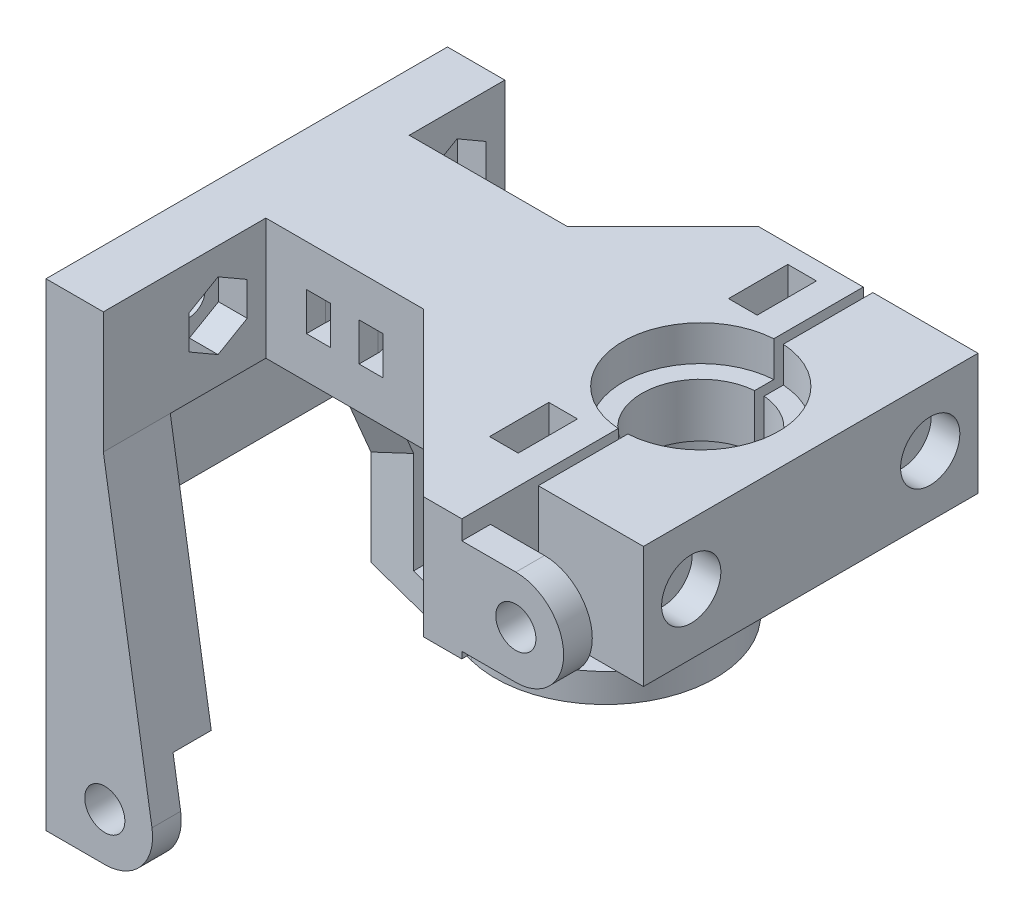
from build123d import *

# Parameters (mm, degrees)
SKETCH_13_R               = 6.15
EXTRUDE_4_DEPTH           = 12.7
CUT_EXTRUDE_11_DEPTH      = 0.5
CUT_EXTRUDE_11_DEPTH_BACK = 0.5
SKETCH_15_W               = 35
SKETCH_15_H               = 12.7
SKETCH_14_R               = 3.1
SKETCH_14_R_2             = 1.65
CUT_EXTRUDE_12_DEPTH      = 3
SKETCH_14_3_R             = 1.65
CUT_EXTRUDE_13_DEPTH      = 25
SKETCH_16_W               = 6.2
SKETCH_16_H               = 12.7
CUT_EXTRUDE_14_DEPTH      = 3
SKETCH_17_R               = 8.15
SKETCH_17_R_2             = 6.15
CUT_EXTRUDE_30_DEPTH      = 3.7
CUT_EXTRUDE_31_DEPTH      = 3.4
SKETCH_19_R               = 1.65
CUT_EXTRUDE_32_DEPTH      = 6
CUT_EXTRUDE_33_DEPTH      = 3
SKETCH_21_W               = 3
SKETCH_21_H               = 35
EXTRUDE_5_DEPTH           = 10
SKETCH_22_R               = 2.1
EXTRUDE_6_DEPTH           = 7
SKETCH_41_W               = 15.059328192
SKETCH_41_H               = 11.44904226
CUT_EXTRUDE_34_DEPTH      = 4
SKETCH_42_W               = 10.65
SKETCH_42_H               = 4
CUT_EXTRUDE_35_DEPTH      = 10
CUT_EXTRUDE_36_DEPTH      = 12.7
EXTRUDE_7_DEPTH           = 12.7
EXTRUDE_8_REACH           = 76.502
SKETCH_44_R               = 6.5
EXTRUDE_9_DEPTH           = 3
EXTRUDE_14_DEPTH          = 3
CUT_EXTRUDE_37_DEPTH      = 2
CUT_EXTRUDE_37_DEPTH_BACK = 2
SKETCH_46_R               = 1.65
EXTRUDE_12_DEPTH          = 0.2
SKETCH_47_R               = 1.65
EXTRUDE_13_DEPTH          = 0.2
EXTRUDE_15_REACH          = 75.95
EXTRUDE_16_REACH          = 75.95


with BuildPart() as part:
    # 草圖13 → 填料-伸長4 (new body)
    with BuildSketch(Plane(origin=(0, 0, 0), x_dir=(1, 0, 0), z_dir=(0, 1, 0))):
        Polygon((0, 17.5), (0, -17.5), (6, -17.5), (6, -7.5), (22.5, -7.5), (32.5, -17.5), (55.5, -17.5), (55.5, 17.5), (32.5, 17.5), (22.5, 7.5), (6, 7.5), (6, 17.5), align=None)
        with Locations(Location((44, 0, 0), (0, 0, 270))):
            Circle(SKETCH_13_R, mode=Mode.SUBTRACT)
    extrude(amount=-EXTRUDE_4_DEPTH)

    # 草圖15 → 除料-伸長11 (cut, two sides: drawn at the far end of the back side and taken through both)
    with BuildSketch(Plane.ZY.offset(-44).offset(-CUT_EXTRUDE_11_DEPTH_BACK)):
        with Locations((0, -6.35)):
            Rectangle(SKETCH_15_W, SKETCH_15_H)
    extrude(amount=CUT_EXTRUDE_11_DEPTH + CUT_EXTRUDE_11_DEPTH_BACK, mode=Mode.SUBTRACT)


with BuildPart() as cut_extrude_11_piece_1:
    # of the separate pieces the step leaves, piece 1, a body of its own (cut_extrude_11_pieces)
    add(part.part.solids().sort_by_distance((0, 0, -17.5))[0])


with BuildPart() as cut_extrude_11_piece_2:
    # of the separate pieces the step leaves, piece 2, a body of its own (cut_extrude_11_pieces)
    add(part.part.solids().sort_by_distance((55.5, 0, -17.5))[0])

    # 草圖14 → 除料-伸長12 (cut)
    # profile 1 of 2: a face of its own
    with BuildSketch(Plane.ZY.offset(-55.5)):
        with Locations(Location((-12.5, -6.35, 0), (0, 0, 180))):
            Circle(SKETCH_14_R)
        with Locations(Location((-12.5, -6.35, 0), (0, 0, 180))):
            Circle(SKETCH_14_R_2, mode=Mode.SUBTRACT)
    # profile 2 of 2: a face of its own
    with BuildSketch(Plane.ZY.offset(-55.5)):
        with Locations(Location((12.5, -6.35, 0), (0, 0, 180))):
            Circle(SKETCH_14_R)
        with Locations(Location((12.5, -6.35, 0), (0, 0, 180))):
            Circle(SKETCH_14_R_2, mode=Mode.SUBTRACT)
    extrude(amount=CUT_EXTRUDE_12_DEPTH, mode=Mode.SUBTRACT)


with BuildPart() as cut_extrude_13_tool:
    # 草圖14<3> → 除料-伸長13 (new body)
    with BuildSketch(Plane.ZY.offset(-55.5)):
        with Locations(Location((-12.5, -6.35, 0), (0, 0, 180))):
            Circle(SKETCH_14_3_R)
        with Locations(Location((12.5, -6.35, 0), (0, 0, 180))):
            Circle(SKETCH_14_3_R)
    extrude(amount=CUT_EXTRUDE_13_DEPTH)


with BuildPart() as cut_extrude_11_piece_1_1:
    add(cut_extrude_11_piece_1.part)

    # 除料-伸長13: cut by cut_extrude_13_tool
    add(cut_extrude_13_tool.part, mode=Mode.SUBTRACT)

    # 草圖16 → 除料-伸長14 (cut)
    with BuildSketch(Plane(origin=(37.5, 0, 0), x_dir=(0, 0, -1), z_dir=(1, 0, 0))):
        with Locations((-12.5, -6.35)):
            Rectangle(SKETCH_16_W, SKETCH_16_H)
        with Locations((12.5, -6.35)):
            Rectangle(SKETCH_16_W, SKETCH_16_H)
    extrude(amount=CUT_EXTRUDE_14_DEPTH, mode=Mode.SUBTRACT)


with BuildPart() as cut_extrude_11_piece_2_1:
    add(cut_extrude_11_piece_2.part)

    # 除料-伸長13: cut by cut_extrude_13_tool
    add(cut_extrude_13_tool.part, mode=Mode.SUBTRACT)


with BuildPart() as cut_extrude_30_tool:
    # 草圖17 → 除料-伸長30 (new body)
    with BuildSketch(Plane(origin=(0, 0, 0), x_dir=(1, 0, 0), z_dir=(0, 1, 0))):
        with Locations((44, 0)):
            Circle(SKETCH_17_R)
        with Locations((44, 0)):
            Circle(SKETCH_17_R_2, mode=Mode.SUBTRACT)
    extrude(amount=-CUT_EXTRUDE_30_DEPTH)


with BuildPart() as cut_extrude_11_piece_1_2:
    add(cut_extrude_11_piece_1_1.part)

    # 除料-伸長30: cut by cut_extrude_30_tool
    add(cut_extrude_30_tool.part, mode=Mode.SUBTRACT)


with BuildPart() as cut_extrude_11_piece_2_2:
    add(cut_extrude_11_piece_2_1.part)

    # 除料-伸長30: cut by cut_extrude_30_tool
    add(cut_extrude_30_tool.part, mode=Mode.SUBTRACT)


with BuildPart() as cut_extrude_31_tool:
    # 草圖18 → 除料-伸長31 (new body)
    with BuildSketch(Plane.XZ.offset(12.7)):
        with BuildLine():
            ThreePointArc((43.5, -8.134648118), (49.583345771, -5.937065774), (52.15, 0))
            ThreePointArc((52.15, 0), (49.583345771, 5.937065774), (43.5, 8.134648118))
            Line((43.5, 8.134648118), (43.5, 6.129641099))
            ThreePointArc((43.5, 6.129641099), (48.168183057, 4.522029412), (50.15, 0))
            ThreePointArc((50.15, 0), (48.168183057, -4.522029412), (43.5, -6.129641099))
            Line((43.5, -6.129641099), (43.5, -8.134648118))
        make_face()
        with BuildLine():
            Line((43.5, 6.129641099), (43.5, 8.134648118))
            ThreePointArc((43.5, 8.134648118), (35.85, 0), (43.5, -8.134648118))
            Line((43.5, -8.134648118), (43.5, -6.129641099))
            ThreePointArc((43.5, -6.129641099), (37.85, 0), (43.5, 6.129641099))
        make_face()
    extrude(amount=-CUT_EXTRUDE_31_DEPTH)


with BuildPart() as cut_extrude_11_piece_1_3:
    add(cut_extrude_11_piece_1_2.part)

    # 除料-伸長31: cut by cut_extrude_31_tool
    add(cut_extrude_31_tool.part, mode=Mode.SUBTRACT)

    # 草圖19 → 除料-伸長32 (cut)
    with BuildSketch(Plane.ZY):
        with Locations(Location((-12.5, -6.35, 0), (0, 0, 180))):
            Circle(SKETCH_19_R)
        with Locations(Location((12.5, -6.35, 0), (0, 0, 180))):
            Circle(SKETCH_19_R)
    extrude(amount=-CUT_EXTRUDE_32_DEPTH, mode=Mode.SUBTRACT)

    # 草圖20 → 除料-伸長33 (cut)
    with BuildSketch(Plane(origin=(6, 0, 0), x_dir=(0, 0, -1), z_dir=(1, 0, 0))):
        Polygon((-12.5, -2.828163358), (-15.55, -4.589081679), (-15.55, -8.110918321), (-12.5, -9.871836642), (-9.45, -8.110918321), (-9.45, -4.589081679), align=None)
        Polygon((12.5, -2.828163358), (9.45, -4.589081679), (9.45, -8.110918321), (12.5, -9.871836642), (15.55, -8.110918321), (15.55, -4.589081679), align=None)
    extrude(amount=-CUT_EXTRUDE_33_DEPTH, mode=Mode.SUBTRACT)

    # 草圖21 → 填料-伸長5 (add)
    with BuildSketch(Plane.XZ.offset(12.7)):
        with Locations((1.5, 0)):
            Rectangle(SKETCH_21_W, SKETCH_21_H)
    extrude(amount=EXTRUDE_5_DEPTH)



with BuildPart() as cut_extrude_11_piece_2_3:
    add(cut_extrude_11_piece_2_2.part)

    # 除料-伸長31: cut by cut_extrude_31_tool
    add(cut_extrude_31_tool.part, mode=Mode.SUBTRACT)


with BuildPart() as cut_extrude_11_piece_1_4:
    add(cut_extrude_11_piece_1_3.part)

    add(cut_extrude_11_piece_2_3.part)  # 填料-伸長6 merges 除料-伸長11 piece 2
    # 草圖22 → 填料-伸長6 (add)
    # profile 1 of 2: a face of its own
    with BuildSketch(Plane.XY.offset(24.5)):
        with BuildLine():
            Line((6, 0), (0, 0))
            Line((0, 0), (0, -50))
            Line((0, -50), (6.15, -50))
            ThreePointArc((6.15, -50), (9.956874308, -48.241559502), (11.086083834, -44.203083202))
            Line((11.086083834, -44.203083202), (6, -12.7))
            Line((6, -12.7), (6, 0))
        make_face()
        with Locations((6.15, -45)):
            Circle(SKETCH_22_R, mode=Mode.SUBTRACT)
    # profile 2 of 2: a face of its own
    with BuildSketch(Plane.XY.offset(24.5)):
        with BuildLine():
            Line((43.5, -12), (49.15, -12))
            ThreePointArc((49.15, -12), (54.15, -7), (49.15, -2))
            Line((49.15, -2), (43.5, -2))
            Line((43.5, -2), (43.5, 0))
            Line((43.5, 0), (38, 0))
            Line((38, 0), (38, -12.7))
            Line((38, -12.7), (43.5, -12.7))
            Line((43.5, -12.7), (43.5, -12))
        make_face()
        with Locations((49.15, -7)):
            Circle(SKETCH_22_R, mode=Mode.SUBTRACT)
    extrude(amount=-EXTRUDE_6_DEPTH)

    # 草圖41 → 除料-伸長34 (cut)
    with BuildSketch(Plane(origin=(0, 0, 17.5), x_dir=(-1, 0, 0), z_dir=(0, 0, -1))):
        with Locations((-6.15, -45)):
            Rectangle(SKETCH_41_W, SKETCH_41_H)
    extrude(amount=-CUT_EXTRUDE_34_DEPTH, mode=Mode.SUBTRACT)

    # 草圖42 → 除料-伸長35 (cut)
    with BuildSketch(Plane(origin=(0, -2, 0), x_dir=(1, 0, 0), z_dir=(0, 1, 0))):
        with Locations((48.825, -19.5)):
            Rectangle(SKETCH_42_W, SKETCH_42_H)
    extrude(amount=-CUT_EXTRUDE_35_DEPTH, mode=Mode.SUBTRACT)


with BuildPart() as cut_extrude_35_piece_1:
    # of the separate pieces the step leaves, piece 1, a body of its own (cut_extrude_35_pieces)
    add(cut_extrude_11_piece_1_4.part.solids().sort_by_distance((43.5, -12.7, 8.134648118))[0])

    # 草圖43 → 除料-伸長36 (cut)
    with BuildSketch(Plane(origin=(0, 0, 0), x_dir=(1, 0, 0), z_dir=(0, 1, 0))):
        Polygon((39.5, -24.5), (38, -23), (38, -24.5), align=None)
    extrude(amount=-CUT_EXTRUDE_36_DEPTH, mode=Mode.SUBTRACT)

    # 草圖43<3> → 填料-伸長7 (add)
    with BuildSketch(Plane(origin=(0, 0, 0), x_dir=(1, 0, 0), z_dir=(0, 1, 0))):
        Polygon((38, -17.5), (32.5, -17.5), (38, -23), align=None)
    extrude(amount=-EXTRUDE_7_DEPTH)

    # 填料-伸長8: up to this face of the body (flat: up to its plane)
    extrude_8_end = Plane(cut_extrude_35_piece_1.part.faces().sort_by_distance((0, -14.517415813, 6.006004348))[0])
    # 草圖34 → 填料-伸長8 (add, up to the picked face)
    with BuildSketch(Plane(origin=(6, 0, 0), x_dir=(0, 0, -1), z_dir=(1, 0, 0)), mode=Mode.PRIVATE) as extrude_8_sk1:
        Polygon((24.5, -32.7), (17.5, -16.200874589), (17.5, -22.7), (9.5, -22.7), (9.5, -32.7), (9.5, -42.7), (24.5, -42.7), align=None)
    extrude_8_tool1 = split(extrude(extrude_8_sk1.sketch, amount=-EXTRUDE_8_REACH, mode=Mode.PRIVATE), bisect_by=extrude_8_end, keep=Keep.BOTH, mode=Mode.PRIVATE)
    # 草圖34 → 填料-伸長8 (add, up to the picked face)
    with BuildSketch(Plane(origin=(6, 0, 0), x_dir=(0, 0, -1), z_dir=(1, 0, 0)), mode=Mode.PRIVATE) as extrude_8_sk2:
        Polygon((9.5, -32.7), (9.5, -22.7), (5.257350874, -22.7), align=None)
    extrude_8_tool2 = split(extrude(extrude_8_sk2.sketch, amount=-EXTRUDE_8_REACH, mode=Mode.PRIVATE), bisect_by=extrude_8_end, keep=Keep.BOTH, mode=Mode.PRIVATE)
    add(extrude_8_tool1.solids().sort_by(Axis((6, -32.812629, -16.595535), (-1, 0, 0)))[0])
    add(extrude_8_tool2.solids().sort_by(Axis((6, -26.033333, -8.085784), (-1, 0, 0)))[0])

    # 草圖44 → 填料-伸長9 (add)
    with BuildSketch(Plane.XZ.offset(42.7)):
        with BuildLine():
            Line((6, -24.5), (0, -24.5))
            Line((0, -24.5), (14.134039996, -28.137157324))
            ThreePointArc((14.134039996, -28.137157324), (28.5, -17), (14.134039996, -5.862842676))
            Line((14.134039996, -5.862842676), (0, -9.5))
            Line((0, -9.5), (6, -9.5))
            Line((6, -9.5), (6, -24.5))
        make_face()
        with Locations(Location((17, -17, 0), (0, 0, 270))):
            Circle(SKETCH_44_R, mode=Mode.SUBTRACT)
    extrude(amount=-EXTRUDE_9_DEPTH)

    # 草圖34<5> → 填料-伸長14 (add)
    with BuildSketch(Plane(origin=(6, 0, 0), x_dir=(0, 0, -1), z_dir=(1, 0, 0))):
        Polygon((17.5, -12.7), (9.5, -12.7), (5.257350874, -12.7), (5.257350874, -22.7), (17.5, -22.7), align=None)
    extrude(amount=-EXTRUDE_14_DEPTH)

    # 草圖39 → 除料-伸長37 (cut, two sides: drawn at the far end of the back side and taken through both)
    with BuildSketch(Plane(origin=(0, -6.35, 0), x_dir=(1, 0, 0), z_dir=(0, 1, 0)).offset(-CUT_EXTRUDE_37_DEPTH_BACK)):
        with BuildLine():
            Line((12.75, -7.5), (12.75, -5.5))
            ThreePointArc((12.75, -5.5), (14.25, -4), (15.75, -5.5))
            Line((15.75, -5.5), (15.75, -7.5))
            Line((15.75, -7.5), (17.714101615, -7.5))
            ThreePointArc((17.714101615, -7.5), (18.113703305, -6.53527618), (18.25, -5.5))
            ThreePointArc((18.25, -5.5), (14.25, -1.5), (10.25, -5.5))
            ThreePointArc((10.25, -5.5), (10.386296695, -6.53527618), (10.785898385, -7.5))
            Line((10.785898385, -7.5), (12.75, -7.5))
        make_face()
        with BuildLine():
            Line((10.25, -7.5), (10.785898385, -7.5))
            ThreePointArc((10.785898385, -7.5), (10.386296695, -6.53527618), (10.25, -5.5))
            Line((10.25, -5.5), (10.25, -7.5))
        make_face()
        with BuildLine():
            ThreePointArc((18.25, -5.5), (18.113703305, -6.53527618), (17.714101615, -7.5))
            Line((17.714101615, -7.5), (18.25, -7.5))
            Line((18.25, -7.5), (18.25, -5.5))
        make_face()
    extrude(amount=CUT_EXTRUDE_37_DEPTH + CUT_EXTRUDE_37_DEPTH_BACK, mode=Mode.SUBTRACT)

    # 草圖47 → 填料-伸長13 (add)
    with BuildSketch(Plane.ZY.offset(-40.5)):
        with Locations(Location((12.5, -6.35, 0), (0, 0, 180))):
            Circle(SKETCH_47_R)
        with Locations(Location((-12.5, -6.35, 0), (0, 0, 180))):
            Circle(SKETCH_47_R)
    extrude(amount=-EXTRUDE_13_DEPTH)

    # 填料-伸長15: up to this face of the body (flat: up to its plane)
    extrude_15_end = Plane(cut_extrude_35_piece_1.part.faces().sort_by_distance((3, -24.450437294, -21))[0])
    # 草圖48 → 填料-伸長15 (add, up to the picked face)
    with BuildSketch(Plane(origin=(0, -39.7, 0), x_dir=(1, 0, 0), z_dir=(0, 1, 0)), mode=Mode.PRIVATE) as extrude_15_sk1:
        Polygon((0, 24.5), (6, 24.5), (6, 26.043999023), align=None)
    extrude_15_tool1 = split(extrude(extrude_15_sk1.sketch, amount=EXTRUDE_15_REACH, mode=Mode.PRIVATE), bisect_by=extrude_15_end, keep=Keep.BOTH, mode=Mode.PRIVATE)
    add(extrude_15_tool1.solids().sort_by(Axis((4, -39.7, -25.014666), (0, 1, 0)))[0])

    # 填料-伸長16: up to this face of the body (flat: up to its plane)
    extrude_16_end = Plane(cut_extrude_35_piece_1.part.faces().sort_by_distance((3, -27.7, -7.378675437))[0])
    # 草圖48<3> → 填料-伸長16 (add, up to the picked face)
    with BuildSketch(Plane(origin=(0, -39.7, 0), x_dir=(1, 0, 0), z_dir=(0, 1, 0)), mode=Mode.PRIVATE) as extrude_16_sk1:
        Polygon((6, 9.5), (0, 9.5), (6, 7.956000977), align=None)
    extrude_16_tool1 = split(extrude(extrude_16_sk1.sketch, amount=EXTRUDE_16_REACH, mode=Mode.PRIVATE), bisect_by=extrude_16_end, keep=Keep.BOTH, mode=Mode.PRIVATE)
    add(extrude_16_tool1.solids().sort_by(Axis((4, -39.7, -8.985334), (0, 1, 0)))[0])


with BuildPart() as cut_extrude_35_piece_2:
    # of the separate pieces the step leaves, piece 2, a body of its own (cut_extrude_35_pieces)
    add(cut_extrude_11_piece_1_4.part.solids().sort_by_distance((55.5, 0, 17.5))[0])

    # 草圖46 → 填料-伸長12 (add)
    with BuildSketch(Plane(origin=(52.5, 0, 0), x_dir=(0, 0, -1), z_dir=(1, 0, 0))):
        with Locations(Location((-12.5, -6.35, 0), (0, 0, 180))):
            Circle(SKETCH_46_R)
        with Locations(Location((12.5, -6.35, 0), (0, 0, 180))):
            Circle(SKETCH_46_R)
    extrude(amount=-EXTRUDE_12_DEPTH)


solid = Compound([cut_extrude_35_piece_1.part, cut_extrude_35_piece_2.part])
